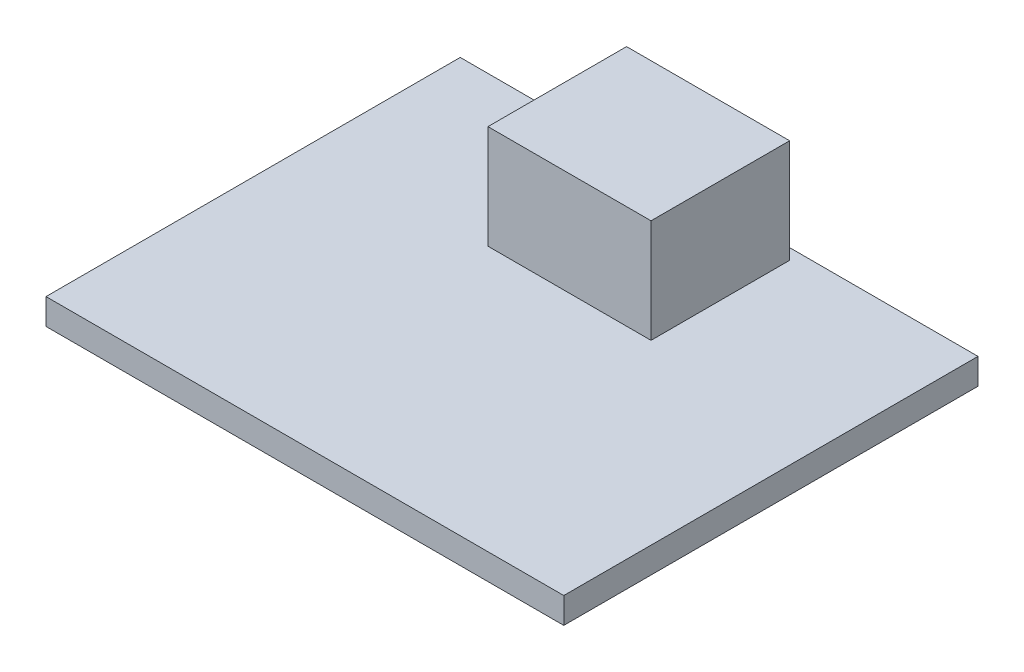
from build123d import *

# Parameters (mm, degrees)
SKETCH2_W           = 127
SKETCH2_H           = 101.6
BOSS_EXTRUDE1_DEPTH = 6.35
SKETCH3_W           = 40
SKETCH3_H           = 34
BOSS_EXTRUDE2_DEPTH = 25.4


with BuildPart() as part:
    # Sketch2 → Boss-Extrude1 (new body)
    with BuildSketch(Plane(origin=(0, 0, 0), x_dir=(1, 0, 0), z_dir=(0, 1, 0))):
        Rectangle(SKETCH2_W, SKETCH2_H)
    extrude(amount=BOSS_EXTRUDE1_DEPTH)

    # Sketch3 → Boss-Extrude2 (add)
    with BuildSketch(Plane(origin=(0, 6.35, 0), x_dir=(1, 0, 0), z_dir=(0, 1, 0))):
        with Locations((0, 31.1)):
            Rectangle(SKETCH3_W, SKETCH3_H)
    extrude(amount=BOSS_EXTRUDE2_DEPTH)


solid = part.part
